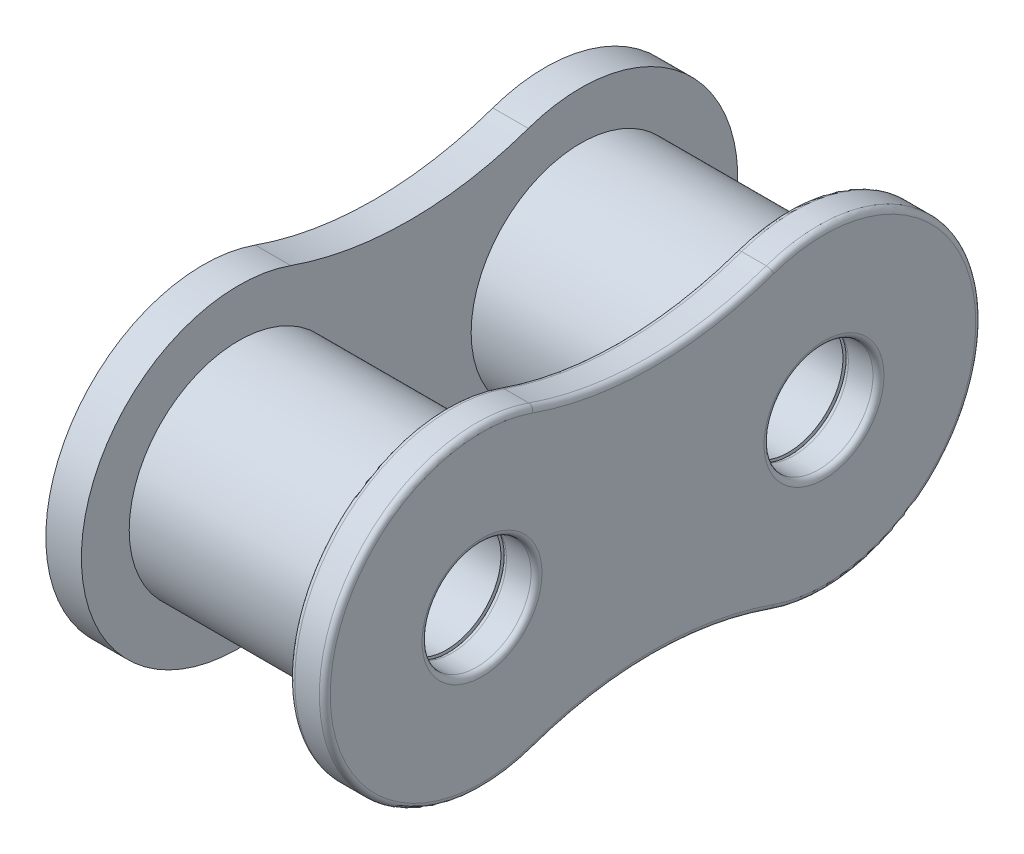
from build123d import *

# Parameters (mm, degrees)
SKETCH1_R           = 2.53
BOSS_EXTRUDE1_DEPTH = 1.65
FILLET1_R           = 0.254
BOSS_EXTRUDE2_START = 9.65
SKETCH2_R           = 5.08
SKETCH2_R_2         = 2.53
BOSS_EXTRUDE2_DEPTH = 9.65


with BuildPart() as part:
    # Sketch1 → Boss-Extrude1 (new body)
    with BuildSketch(Plane(origin=(0, 0, 0), x_dir=(0, 0, -1), z_dir=(1, 0, 0))):
        with BuildLine():
            ThreePointArc((-5.513869751, 6.885928871), (-15.2375, 0), (-5.513869751, -6.885928871))
            ThreePointArc((-5.513869751, -6.885928871), (0, -5.943898099), (5.513869751, -6.885928871))
            ThreePointArc((5.513869751, -6.885928871), (15.2375, 0), (5.513869751, 6.885928871))
            ThreePointArc((5.513869751, 6.885928871), (0, 5.943898099), (-5.513869751, 6.885928871))
        make_face()
        with Locations((-7.9375, 0)):
            Circle(SKETCH1_R, mode=Mode.SUBTRACT)
        with Locations(Location((7.9375, 0, 0), (0, 0, 180))):
            Circle(SKETCH1_R, mode=Mode.SUBTRACT)
    boss_extrude1 = extrude(amount=BOSS_EXTRUDE1_DEPTH)

    # Fillet1
    fillet1_edges = [part.edges().sort_by_distance(p)[0] for p in [
        (0, 0, 10.4675),
        (1.65, 0, 10.4675),
        (1.65, -5.943898099, 0),
        (0, 0, -10.4675),
        (1.65, 0, -10.4675),
        (1.65, 0, -15.2375),
        (1.65, 5.943898099, 0),
        (0, 0, -15.2375),
        (0, -5.943898099, 0),
        (0, 0, 15.2375),
        (0, 5.943898099, 0),
        (1.65, 0, 15.2375),
    ]]
    fillet(fillet1_edges, radius=FILLET1_R)

    # Sketch2 → Boss-Extrude2 (add)
    with BuildSketch(Plane.ZY.offset(BOSS_EXTRUDE2_START)):
        with Locations(Location((-7.9375, 0, 0), (0, 0, 180))):
            Circle(SKETCH2_R)
        with Locations(Location((-7.9375, 0, 0), (0, 0, 180))):
            Circle(SKETCH2_R_2, mode=Mode.SUBTRACT)
    boss_extrude2 = extrude(amount=-BOSS_EXTRUDE2_DEPTH)

    # Mirror2: Boss-Extrude2 across plane
    add(boss_extrude2.mirror(Plane.XY))

    # Mirror3: Boss-Extrude1 across plane
    add(boss_extrude1.mirror(Plane.ZY.offset(4.825)))


solid = part.part
